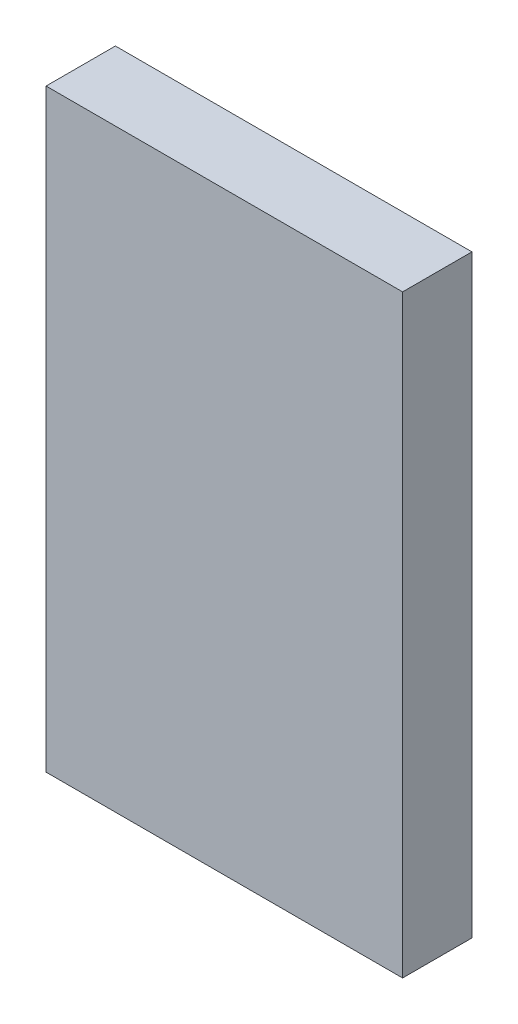
from build123d import *

# Parameters (mm, degrees)
ESQUISSE1_W        = 36
ESQUISSE1_H        = 60
BOSS_EXTRU_1_DEPTH = 7


with BuildPart() as part:
    # Esquisse1 → Boss.-Extru.1 (new body)
    with BuildSketch(Plane.XY):
        with Locations((-0.623224044, -14.916666667)):
            Rectangle(ESQUISSE1_W, ESQUISSE1_H)
    extrude(amount=BOSS_EXTRU_1_DEPTH)


solid = part.part
